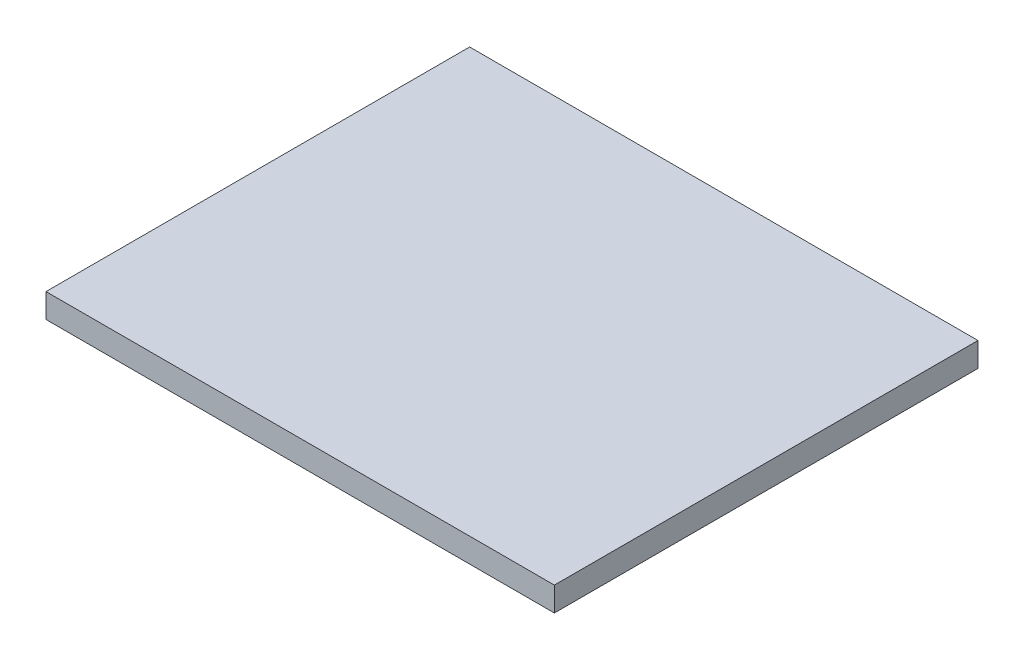
from build123d import *

# Parameters (mm, degrees)
SKETCH1_W           = 42
SKETCH1_H           = 35
BOSS_EXTRUDE1_DEPTH = 2


with BuildPart() as part:
    # Sketch1 → Boss-Extrude1 (new body)
    with BuildSketch(Plane(origin=(0, 0, 0), x_dir=(1, 0, 0), z_dir=(0, 1, 0))):
        Rectangle(SKETCH1_W, SKETCH1_H)
    extrude(amount=BOSS_EXTRUDE1_DEPTH)


solid = part.part
